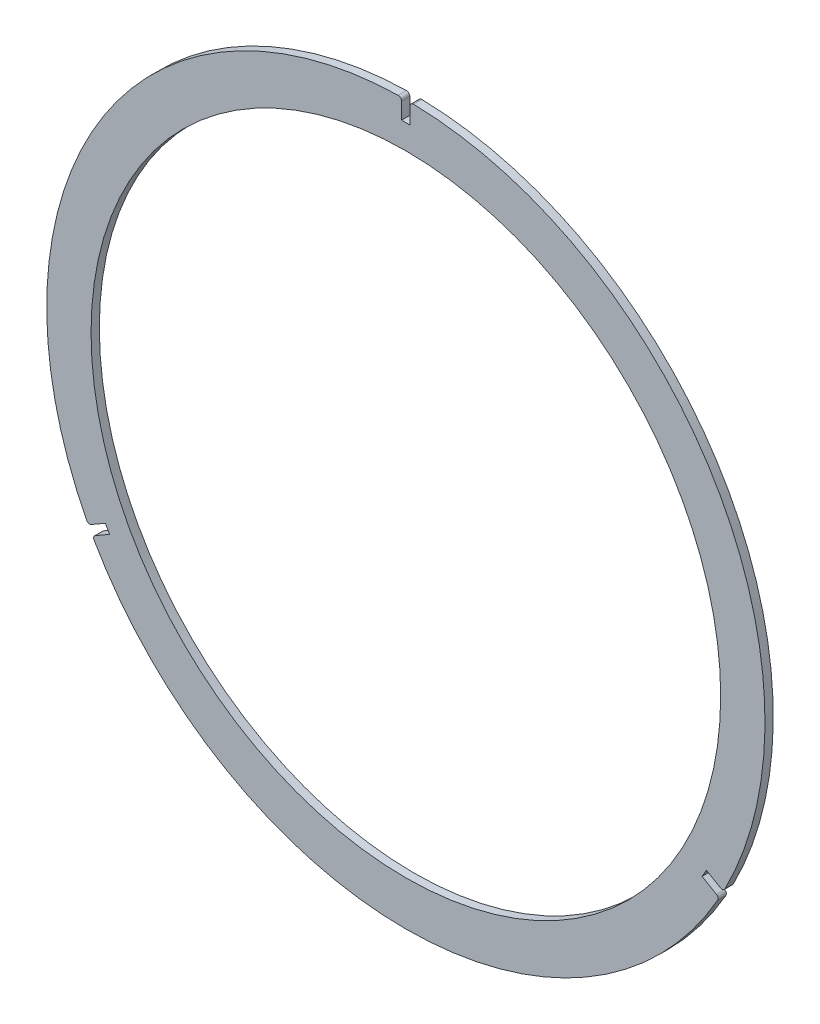
from build123d import *

# Parameters (mm, degrees)
SKETCH1_R           = 120.904
BOSS_EXTRUDE1_DEPTH = 1.5875
FILLET1_R           = 1.27


with BuildPart() as part:
    # Sketch1 → Boss-Extrude1 (new, symmetric)
    with BuildSketch(Plane.XY):
        with BuildLine():
            Line((-1.651, 142.99211797), (-1.651, 150.61211797))
            ThreePointArc((-1.651, 150.61211797), (-116.726759893, 86.166601996), (-125.058359506, -45.462572171))
            ThreePointArc((-125.058359506, -45.462572171), (-124.706816881, -46.212544567), (-124.350776736, -46.960392298))
            ThreePointArc((-124.350776736, -46.960392298), (-123.990582669, -47.705409471), (-123.625925064, -48.44825211))
            ThreePointArc((-123.625925064, -48.44825211), (-122.796227949, -50.097806374), (-121.944521887, -51.736105296))
            Line((-121.944521887, -51.736105296), (-115.42055631, -47.966631906))
            Line((-115.42055631, -47.966631906), (-113.768616335, -50.825704889))
            Line((-113.768616335, -50.825704889), (-120.366477065, -54.63787406))
            ThreePointArc((-120.366477065, -54.63787406), (-0.003414242, -125.221999958), (120.363143036, -54.643833293))
            Line((120.363143036, -54.643833293), (113.765475078, -50.831330502))
            Line((113.765475078, -50.831330502), (115.417559621, -47.972341054))
            Line((115.417559621, -47.972341054), (121.941331564, -51.742142581))
            ThreePointArc((121.941331564, -51.742142581), (122.79307438, -50.103972552), (123.622811136, -48.454547263))
            ThreePointArc((123.622811136, -48.454547263), (123.987506557, -47.711723215), (124.347738551, -46.966724405))
            ThreePointArc((124.347738551, -46.966724405), (124.703816766, -46.218894831), (125.055397569, -45.468940362))
            ThreePointArc((125.055397569, -45.468940362), (116.728630401, 86.163629972), (1.651, 150.61211797))
            Line((1.651, 150.61211797), (1.651, 142.99211797))
            Line((1.651, 142.99211797), (-1.651, 142.99211797))
        make_face()
        with Locations((0, 12.7)):
            Circle(SKETCH1_R, mode=Mode.SUBTRACT)
    extrude(amount=BOSS_EXTRUDE1_DEPTH, both=True)

    # Fillet1
    fillet1_edges = [part.edges().sort_by_distance(p)[0] for p in [
        (120.363143036, -54.643833293, 0),
        (-120.366477065, -54.63787406, 0),
        (-121.944521887, -51.736105296, 0),
        (-1.651, 150.61211797, 0),
        (1.651, 150.61211797, 0),
        (121.941331564, -51.742142581, 0),
    ]]
    fillet(fillet1_edges, radius=FILLET1_R)


solid = part.part
